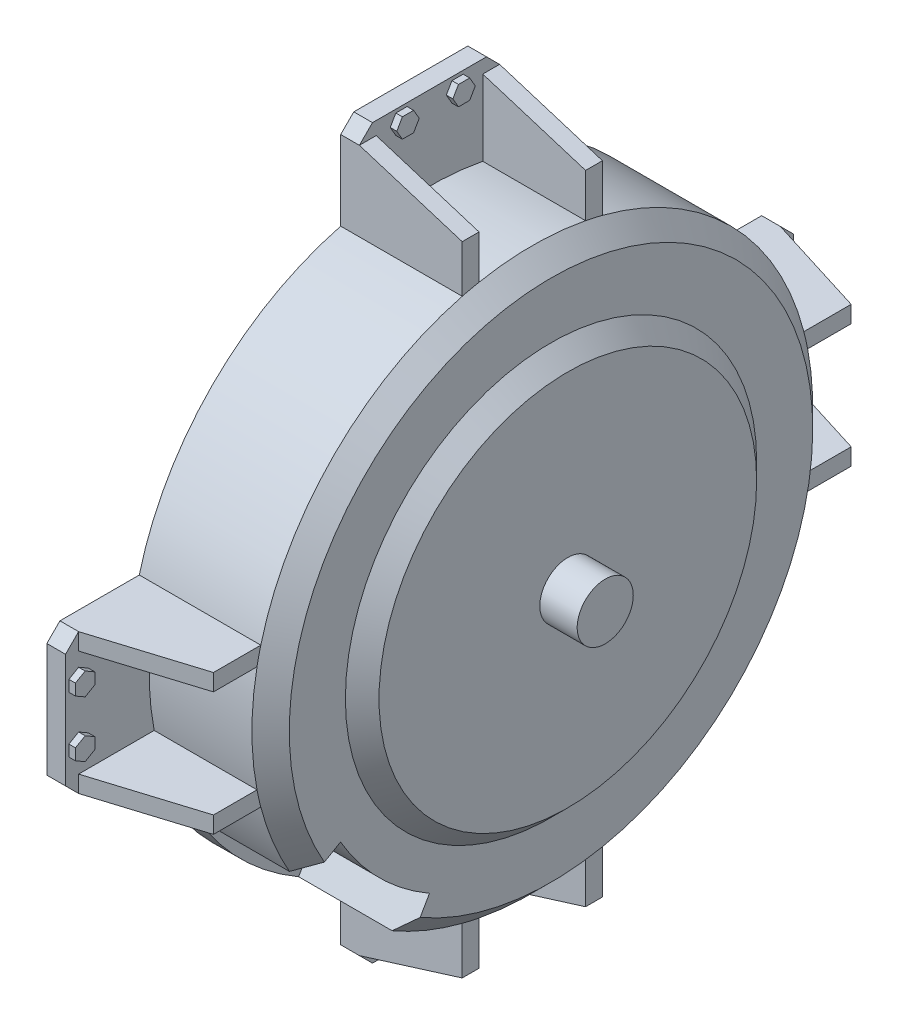
from build123d import *

# Parameters (mm, degrees)
SKETCH2_R                    = 150
BOSS_EXTRUDE1_DEPTH          = 75
CHAMFER1_SIZE                = 10
BOSS_EXTRUDE2_DEPTH          = 10
CHAMFER2_SIZE                = 7
BOSS_EXTRUDE3_DEPTH          = 9
BOSS_EXTRUDE4_DEPTH          = 3.5
CIRPATTERN1_COUNT            = 4
CIRPATTERN1_COPY_1_DEPTH     = 3.5
CIRPATTERN1_COPY_2_DEPTH     = 3.5
CIRPATTERN1_COPY_3_DEPTH     = 3.5
CIRPATTERN1_COPY_4_DEPTH     = 9
CIRPATTERN1_COPY_5_DEPTH     = 9
CIRPATTERN1_COPY_6_DEPTH     = 9
CHAMFER2_OF_CIRPATTERN1_SIZE = 7
CUT_EXTRUDE1_START           = -60
CUT_EXTRUDE1_DEPTH           = 60
SKETCH8_R                    = 110
BOSS_EXTRUDE5_DEPTH          = 9
BOSS_EXTRUDE5_TAPER          = 45
SKETCH9_R                    = 15
BOSS_EXTRUDE6_DEPTH          = 20


with BuildPart() as part:
    # Sketch2 → Boss-Extrude1 (new body)
    with BuildSketch(Plane(origin=(0, 0, 0), x_dir=(0, 0, -1), z_dir=(1, 0, 0))):
        Circle(SKETCH2_R)
    extrude(amount=BOSS_EXTRUDE1_DEPTH)

    # Chamfer1
    chamfer1_edges = [part.edges().sort_by_distance(p)[0] for p in [
        (75, 0, 150),
    ]]
    chamfer(chamfer1_edges, length=CHAMFER1_SIZE)

    # Sketch3 → Boss-Extrude2 (add)
    with BuildSketch(Plane.ZY):
        with BuildLine():
            Line((-37.5, 144.689485183), (-37.5, 194.689485183))
            Line((-37.5, 194.689485183), (37.5, 194.689485183))
            Line((37.5, 194.689485183), (37.5, 144.689485183))
            ThreePointArc((37.5, 144.689485183), (0, 149.470054267), (-37.5, 144.689485183))
        make_face()
    boss_extrude2 = extrude(amount=-BOSS_EXTRUDE2_DEPTH)

    # Chamfer2
    chamfer2_edges = [part.edges().sort_by_distance(p)[0] for p in [
        (5, 194.689485183, 37.5),
        (5, 194.689485183, -37.5),
    ]]
    chamfer(chamfer2_edges, length=CHAMFER2_SIZE)

    # Sketch4 → Boss-Extrude3 (add)
    with BuildSketch(Plane(origin=(0, 0, -37.5), x_dir=(-1, 0, 0), z_dir=(0, 0, -1))):
        Polygon((-10, 145.236875483), (-10, 187.689485183), (-65, 170.556875483), (-65, 145.236875483), align=None)
    boss_extrude3 = extrude(amount=-BOSS_EXTRUDE3_DEPTH)

    # Sketch5 → Boss-Extrude4 (add)
    with BuildSketch(Plane(origin=(10, 0, 0), x_dir=(0, 0, -1), z_dir=(1, 0, 0))):
        Polygon((21, 187.689485183), (18, 192.885637605), (12, 192.885637605), (9, 187.689485183), (12, 182.49333276), (18, 182.49333276), align=None)
    boss_extrude4 = extrude(amount=BOSS_EXTRUDE4_DEPTH)

    # Mirror1: Boss-Extrude4 across plane
    add(boss_extrude4.mirror(Plane.XY))

    # Mirror2: Boss-Extrude3 across plane
    add(boss_extrude3.mirror(Plane.XY))

    # CirPattern1: Boss-Extrude2, Boss-Extrude3, Boss-Extrude4 ×4 about axis
    cirpattern1_axis = Axis((0, 0, 0), (1, 0, 0))
    add([boss_extrude2.rotate(cirpattern1_axis, i * 360 / CIRPATTERN1_COUNT) for i in range(1, CIRPATTERN1_COUNT)])
    add([boss_extrude3.rotate(cirpattern1_axis, i * 360 / CIRPATTERN1_COUNT) for i in range(1, CIRPATTERN1_COUNT)])
    add([boss_extrude4.rotate(cirpattern1_axis, i * 360 / CIRPATTERN1_COUNT) for i in range(1, CIRPATTERN1_COUNT)])

    # CirPattern1 copy 1 sketch → CirPattern1 copy 1 (add)
    with BuildSketch(Plane(origin=(10, 0, 0), x_dir=(0, -1, 0), z_dir=(1, 0, 0))):
        Polygon((21, -187.689485183), (18, -192.885637605), (12, -192.885637605), (9, -187.689485183), (12, -182.49333276), (18, -182.49333276), align=None)
    extrude(amount=CIRPATTERN1_COPY_1_DEPTH)

    # CirPattern1 copy 2 sketch → CirPattern1 copy 2 (add)
    with BuildSketch(Plane(origin=(10, 0, 0), x_dir=(0, 0, -1), z_dir=(1, 0, 0))):
        Polygon((21, -187.689485183), (18, -192.885637605), (12, -192.885637605), (9, -187.689485183), (12, -182.49333276), (18, -182.49333276), align=None)
    extrude(amount=CIRPATTERN1_COPY_2_DEPTH)

    # CirPattern1 copy 3 sketch → CirPattern1 copy 3 (add)
    with BuildSketch(Plane.YZ.offset(10)):
        Polygon((21, -187.689485183), (18, -192.885637605), (12, -192.885637605), (9, -187.689485183), (12, -182.49333276), (18, -182.49333276), align=None)
    extrude(amount=CIRPATTERN1_COPY_3_DEPTH)

    # CirPattern1 copy 4 sketch → CirPattern1 copy 4 (add)
    with BuildSketch(Plane(origin=(0, -37.5, 0), x_dir=(-1, 0, 0), z_dir=(0, -1, 0))):
        Polygon((-10, -145.236875483), (-10, -187.689485183), (-65, -170.556875483), (-65, -145.236875483), align=None)
    extrude(amount=-CIRPATTERN1_COPY_4_DEPTH)

    # CirPattern1 copy 5 sketch → CirPattern1 copy 5 (add)
    with BuildSketch(Plane(origin=(0, 0, -37.5), x_dir=(-1, 0, 0), z_dir=(0, 0, -1))):
        Polygon((-10, -145.236875483), (-10, -187.689485183), (-65, -170.556875483), (-65, -145.236875483), align=None)
    extrude(amount=-CIRPATTERN1_COPY_5_DEPTH)

    # CirPattern1 copy 6 sketch → CirPattern1 copy 6 (add)
    with BuildSketch(Plane(origin=(0, 37.5, 0), x_dir=(-1, 0, 0), z_dir=(0, 1, 0))):
        Polygon((-10, -145.236875483), (-10, -187.689485183), (-65, -170.556875483), (-65, -145.236875483), align=None)
    extrude(amount=-CIRPATTERN1_COPY_6_DEPTH)

    # Chamfer2 of CirPattern1
    chamfer2_of_cirpattern1_edges = [part.edges().sort_by_distance(p)[0] for p in [
        (5, -37.5, 194.689485183),
        (5, 37.5, 194.689485183),
        (5, -194.689485183, -37.5),
        (5, -194.689485183, 37.5),
        (5, 37.5, -194.689485183),
        (5, -37.5, -194.689485183),
    ]]
    chamfer(chamfer2_of_cirpattern1_edges, length=CHAMFER2_OF_CIRPATTERN1_SIZE)

    # Sketch7 → Cut-Extrude1 (cut)
    with BuildSketch(Plane(origin=(75, 0, 0), x_dir=(0, 0, -1), z_dir=(1, 0, 0)).offset(CUT_EXTRUDE1_START)):
        with BuildLine():
            ThreePointArc((-70, -121.24355653), (-98.994949366, -98.994949366), (-121.24355653, -70))
            Line((-121.24355653, -70), (-129.903810568, -75))
            ThreePointArc((-129.903810568, -75), (-106.066017178, -106.066017178), (-75, -129.903810568))
            Line((-75, -129.903810568), (-70, -121.24355653))
        make_face()
        with BuildLine():
            ThreePointArc((-65, -112.583302492), (-91.923881554, -91.923881554), (-112.583302492, -65))
            Line((-112.583302492, -65), (-121.24355653, -70))
            ThreePointArc((-121.24355653, -70), (-98.994949366, -98.994949366), (-70, -121.24355653))
            Line((-70, -121.24355653), (-65, -112.583302492))
        make_face()
    extrude(amount=CUT_EXTRUDE1_DEPTH, mode=Mode.SUBTRACT)

    # Sketch8 → Boss-Extrude5 (add)
    with BuildSketch(Plane(origin=(75, 0, 0), x_dir=(0, 0, -1), z_dir=(1, 0, 0))):
        Circle(SKETCH8_R)
    extrude(amount=BOSS_EXTRUDE5_DEPTH, taper=BOSS_EXTRUDE5_TAPER)

    # Sketch9 → Boss-Extrude6 (add)
    with BuildSketch(Plane(origin=(84, 0, 0), x_dir=(0, 0, -1), z_dir=(1, 0, 0))):
        Circle(SKETCH9_R)
    extrude(amount=BOSS_EXTRUDE6_DEPTH)


solid = part.part
